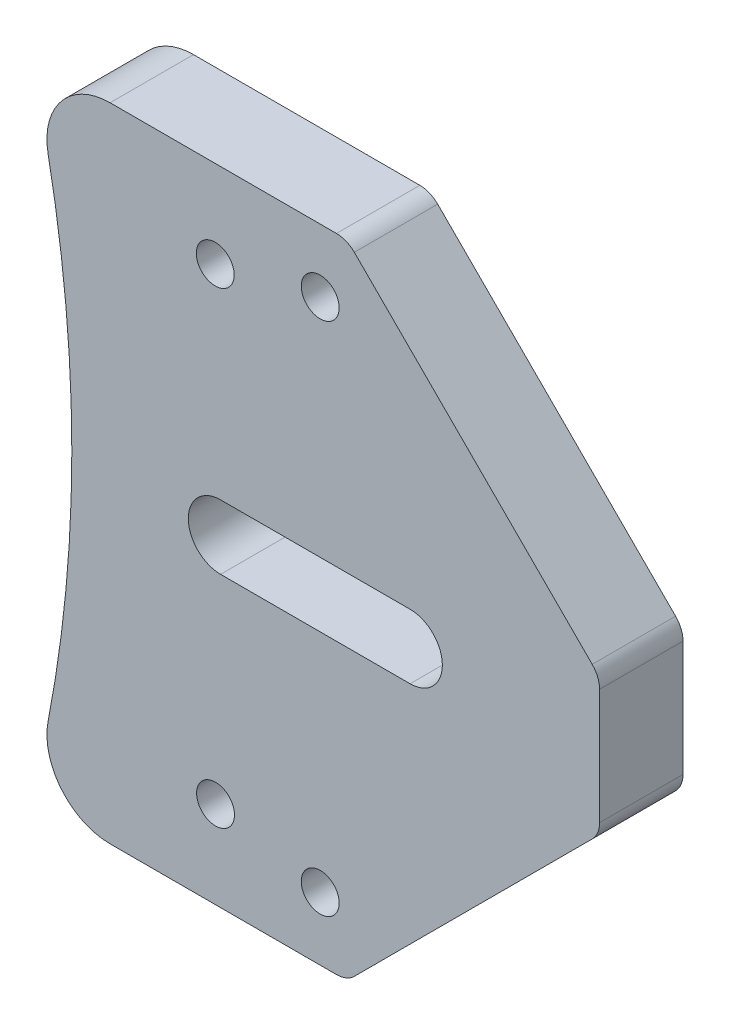
from build123d import *

# Parameters (mm, degrees)
MODEL_R             = 1.5
BOSS_EXTRUDE1_DEPTH = 6.6


with BuildPart() as part:
    # Model → Boss-Extrude1 (new body)
    with BuildSketch(Plane.XY):
        with BuildLine():
            Line((3.085786438, -24.814213562), (21.914213562, -5.985786438))
            ThreePointArc((21.914213562, -5.985786438), (22.347759065, -5.33693974), (22.5, -4.571572875))
            Line((22.5, -4.571572875), (22.5, 4.571572875))
            ThreePointArc((22.5, 4.571572875), (22.347759065, 5.33693974), (21.914213562, 5.985786438))
            Line((21.914213562, 5.985786438), (3.085786438, 24.814213562))
            ThreePointArc((3.085786438, 24.814213562), (2.43693974, 25.247759065), (1.671572875, 25.4))
            Line((1.671572875, 25.4), (-16.243953329, 25.4))
            ThreePointArc((-16.243953329, 25.4), (-20.102984306, 23.579289217), (-21.151543558, 19.44315197))
            ThreePointArc((-21.151543558, 19.44315197), (-19.273776994, 0), (-21.151543558, -19.44315197))
            ThreePointArc((-21.151543558, -19.44315197), (-20.102984306, -23.579289217), (-16.243953329, -25.4))
            Line((-16.243953329, -25.4), (1.671572875, -25.4))
            ThreePointArc((1.671572875, -25.4), (2.43693974, -25.247759065), (3.085786438, -24.814213562))
        make_face()
        with Locations((0.385786438, 20.4)):
            Circle(MODEL_R, mode=Mode.SUBTRACT)
        with Locations((0.385786438, -20.4)):
            Circle(MODEL_R, mode=Mode.SUBTRACT)
        with Locations((-7.922562904, 18.5)):
            Circle(MODEL_R, mode=Mode.SUBTRACT)
        with Locations((-7.899139633, -18.5)):
            Circle(MODEL_R, mode=Mode.SUBTRACT)
        with BuildLine():
            Line((-7.5, -2.5527), (7.5, -2.5527))
            ThreePointArc((7.5, -2.5527), (10.0527, 0), (7.5, 2.5527))
            Line((7.5, 2.5527), (-7.5, 2.5527))
            ThreePointArc((-7.5, 2.5527), (-10.0527, 0), (-7.5, -2.5527))
        make_face(mode=Mode.SUBTRACT)
    extrude(amount=BOSS_EXTRUDE1_DEPTH)


solid = part.part
